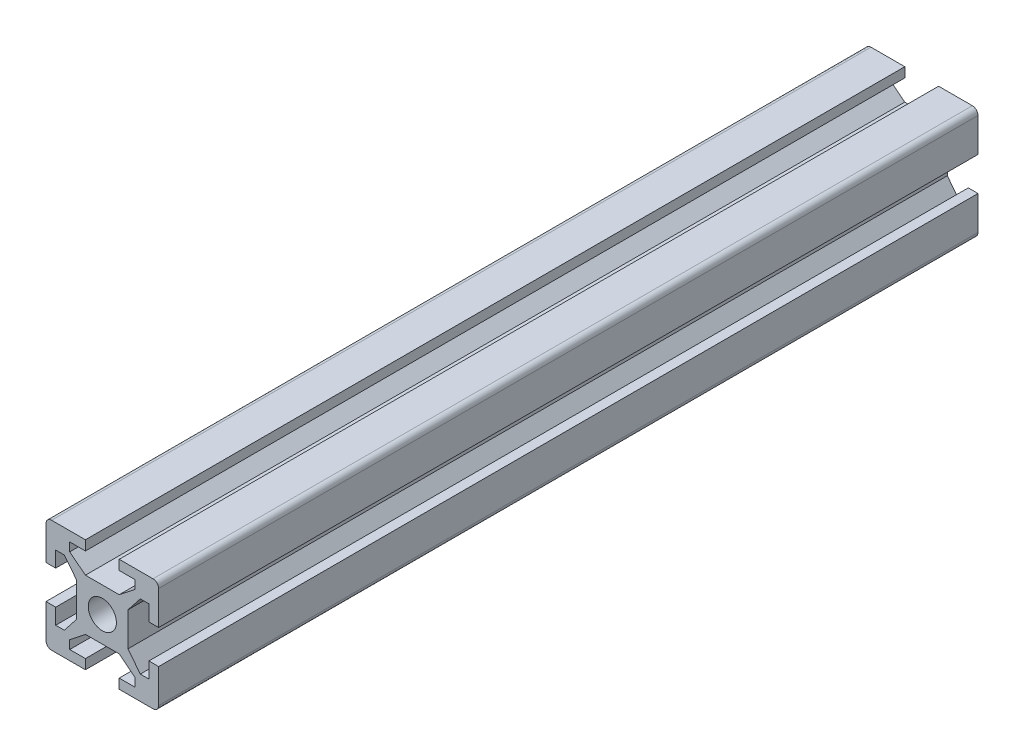
from build123d import *

# Parameters (mm, degrees)
BOSS_EXTRUDE1_DEPTH     = 72.75
CUT_EXTRUDE1_DEPTH      = 147.185669612
CUT_EXTRUDE1_DEPTH_BACK = 147.185669612
SKETCH2_R               = 2.5
FILLET1_R               = 1


with BuildPart() as part:
    # Sketch1 → Boss-Extrude1 (new, symmetric)
    with BuildSketch(Plane.XY):
        Polygon((-10, 10), (-3, 10), (-3, 8.272610059), (-5.783778863, 8.272610059), (-5.783778863, 6.747994248), (-3, 4.550753814), (3, 4.550753814), (5.783778863, 6.747994248), (5.783778863, 8.272610059), (3, 8.272610059), (3, 10), (10, 10), (10, 3), (8.272610059, 3), (8.272610059, 5.783778863), (6.747994248, 5.783778863), (4.55, 3.000595152), (4.55, -2.999404848), (6.747994248, -5.783778863), (8.272610059, -5.783778863), (8.272610059, -3), (10, -3), (10, -10), (3, -10), (3, -8.272610059), (5.783778863, -8.272610059), (5.783778863, -6.747994248), (2.999404848, -4.55), (-3.000595152, -4.55), (-5.783778863, -6.747994248), (-5.783778863, -8.272610059), (-3, -8.272610059), (-3, -10), (-10, -10), (-10, -3), (-8.272610059, -3), (-8.272610059, -5.783778863), (-6.747994248, -5.783778863), (-4.55, -3.000595152), (-4.55, 2.999404848), (-6.747994248, 5.783778863), (-8.272610059, 5.783778863), (-8.272610059, 3), (-10, 3), align=None)
    extrude(amount=BOSS_EXTRUDE1_DEPTH, both=True)

    # Sketch2 → Cut-Extrude1 (cut, two sides: drawn at the far end of the back side and taken through both)
    with BuildSketch(Plane.XY.offset(72.75).offset(-CUT_EXTRUDE1_DEPTH_BACK)):
        Circle(SKETCH2_R)
    extrude(amount=CUT_EXTRUDE1_DEPTH + CUT_EXTRUDE1_DEPTH_BACK, mode=Mode.SUBTRACT)

    # Fillet1
    fillet1_edges = [part.edges().sort_by_distance(p)[0] for p in [
        (-10, 10, 0),
        (10, 10, 0),
        (10, -10, 0),
        (-10, -10, 0),
    ]]
    fillet(fillet1_edges, radius=FILLET1_R)


solid = part.part
